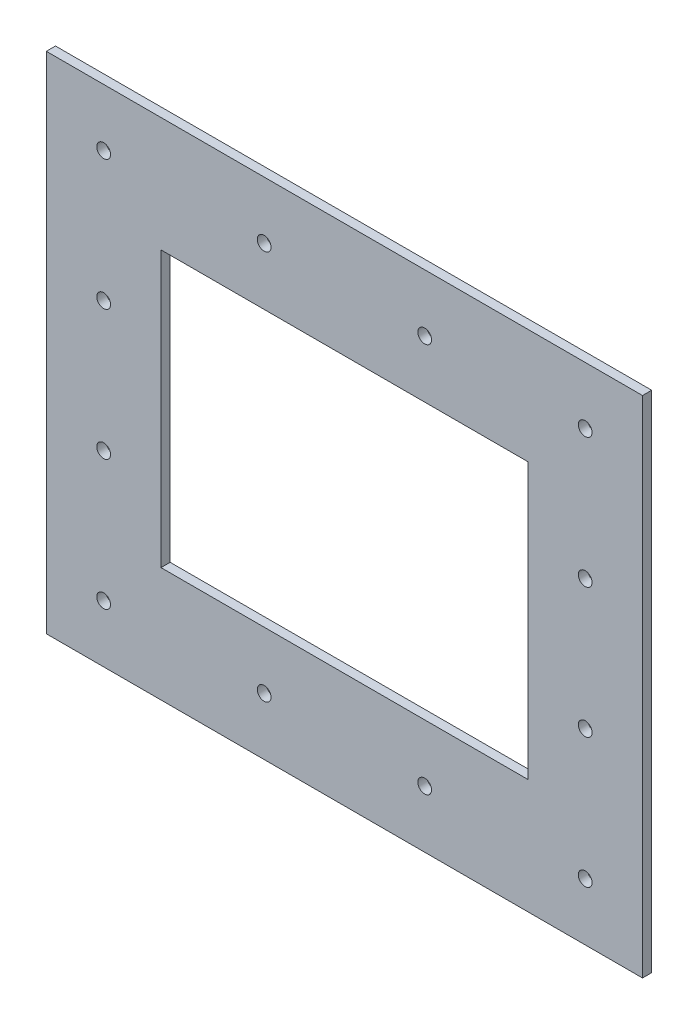
from build123d import *

# Parameters (mm, degrees)
CROQUIS1_W              = 130
CROQUIS1_H              = 110
CROQUIS1_W_2            = 80
CROQUIS1_H_2            = 60
SALIENTE_EXTRUIR1_DEPTH = 2
CROQUIS2_R              = 1.5
CORTAR_EXTRUIR2_DEPTH   = 171.305607659


with BuildPart() as part:
    # Croquis1 → Saliente-Extruir1 (new body)
    with BuildSketch(Plane.XY):
        with Locations((65, 55)):
            Rectangle(CROQUIS1_W, CROQUIS1_H)
        with Locations((65, 55)):
            Rectangle(CROQUIS1_W_2, CROQUIS1_H_2, mode=Mode.SUBTRACT)
    extrude(amount=SALIENTE_EXTRUIR1_DEPTH)

    # Croquis2 → Cortar-Extruir2 (cut, through all)
    with BuildSketch(Plane.XY):
        with Locations((12.5, 97.5)):
            Circle(CROQUIS2_R)
        with Locations((47.5, 97.5)):
            Circle(CROQUIS2_R)
        with Locations((82.5, 97.5)):
            Circle(CROQUIS2_R)
        with Locations((117.5, 97.5)):
            Circle(CROQUIS2_R)
        with Locations((12.5, 69.17)):
            Circle(CROQUIS2_R)
        with Locations((12.5, 40.84)):
            Circle(CROQUIS2_R)
        with Locations(Location((117.5, 12.5, 0), (0, 0, 180))):
            Circle(CROQUIS2_R)
        with Locations(Location((82.5, 12.5, 0), (0, 0, 180))):
            Circle(CROQUIS2_R)
        with Locations(Location((47.5, 12.5, 0), (0, 0, 180))):
            Circle(CROQUIS2_R)
        with Locations(Location((12.5, 12.5, 0), (0, 0, 180))):
            Circle(CROQUIS2_R)
        with Locations(Location((117.5, 40.84, 0), (0, 0, 180))):
            Circle(CROQUIS2_R)
        with Locations(Location((117.5, 69.17, 0), (0, 0, 180))):
            Circle(CROQUIS2_R)
    extrude(amount=CORTAR_EXTRUIR2_DEPTH, mode=Mode.SUBTRACT)


solid = part.part
